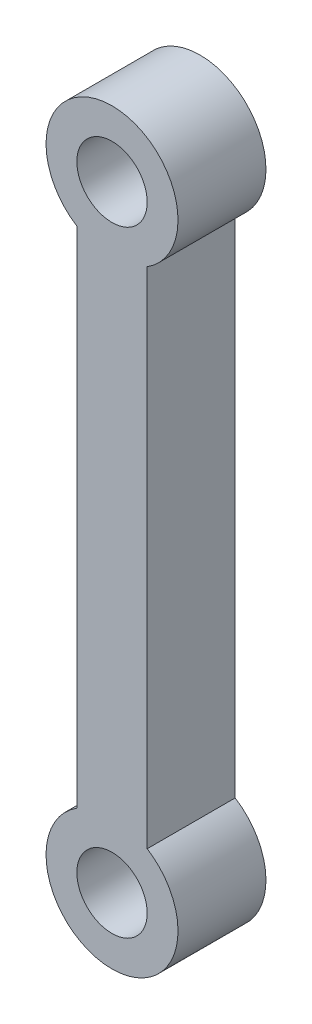
from build123d import *

# Parameters (mm, degrees)
ESBO_O1_R                = 4
RESSALTO_EXTRUS_O1_DEPTH = 10


with BuildPart() as part:
    # Esboço1 → Ressalto-extrusão1 (new body)
    with BuildSketch(Plane.XY):
        with BuildLine():
            Line((4, 63.65571123), (4, 6.34428877))
            ThreePointArc((4, 6.34428877), (0, -7.5), (-4, 6.34428877))
            Line((-4, 6.34428877), (-4, 63.65571123))
            ThreePointArc((-4, 63.65571123), (0, 77.5), (4, 63.65571123))
        make_face()
        with Locations((0, 70)):
            Circle(ESBO_O1_R, mode=Mode.SUBTRACT)
        Circle(ESBO_O1_R, mode=Mode.SUBTRACT)
    extrude(amount=RESSALTO_EXTRUS_O1_DEPTH)


solid = part.part
